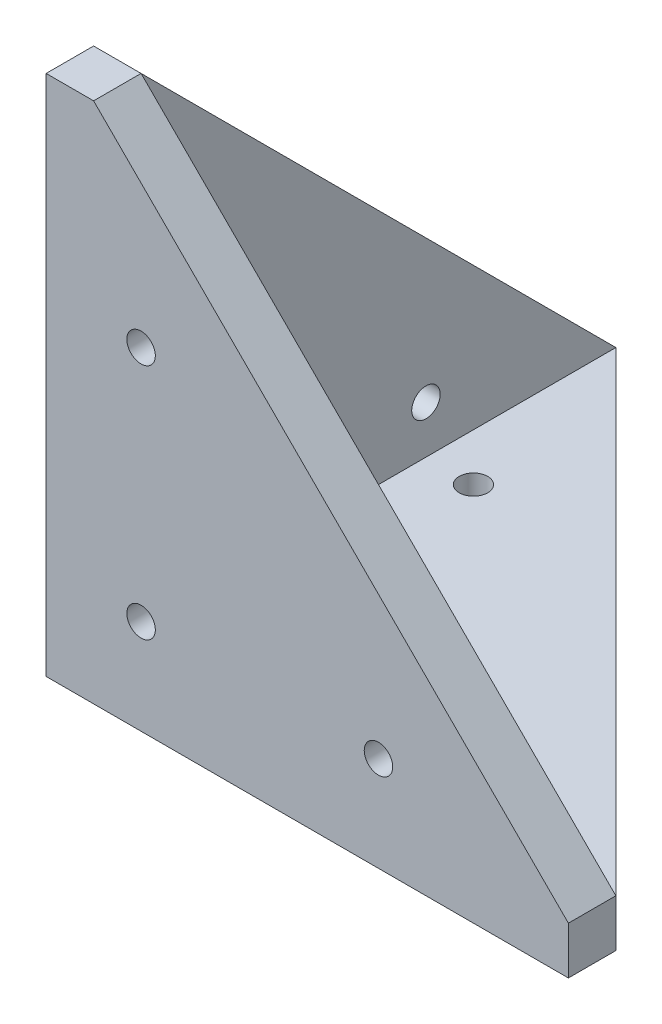
from build123d import *

# Parameters (mm, degrees)
EXTRUDE_1_DEPTH     = 5
EXTRUDE_2_DEPTH     = 5
SKETCH_4_W          = 5
SKETCH_4_H          = 5
EXTRUDE_4_DEPTH     = 50
EXTRUDE_13_DEPTH    = 5
SKETCH_8_R          = 1.5
SKETCH_8_R_2        = 1.4
CUT_EXTRUDE_1_DEPTH = 87.602540378
SKETCH_9_R          = 1.5
CUT_EXTRUDE_2_DEPTH = 87.602540378
SKETCH_10_R         = 1.5
CUT_EXTRUDE_3_DEPTH = 87.602540378


with BuildPart() as part:
    # 草图1 → 凸台-拉伸1 (new body)
    with BuildSketch(Plane.XY):
        Polygon((0, 50), (50, 0), (50, -5), (-5, -5), (-5, 50), align=None)
    extrude(amount=EXTRUDE_1_DEPTH)



with BuildPart() as body_2:
    # 草图2 → 凸台-拉伸2 (new body)
    with BuildSketch(Plane(origin=(0, 0, 0), x_dir=(0, 0, -1), z_dir=(1, 0, 0))):
        Polygon((0, 0), (50, 0), (0, 50), align=None)
    extrude(amount=-EXTRUDE_2_DEPTH)

    # 草图4 → 凸台-拉伸4 (add)
    with BuildSketch(Plane.XY):
        with Locations((-2.5, -2.5)):
            Rectangle(SKETCH_4_W, SKETCH_4_H)
    extrude(amount=-EXTRUDE_4_DEPTH)


with BuildPart() as part_1:
    add(part.part)

    add(body_2.part)  # 凸台-拉伸13 merges body 2
    # 草图7 → 凸台-拉伸13 (add)
    with BuildSketch(Plane.XZ.offset(5)):
        Polygon((50, 0), (0, 0), (0, -50), align=None)
    extrude(amount=-EXTRUDE_13_DEPTH)

    # 草图8 → 切除-拉伸1 (cut, through all)
    with BuildSketch(Plane(origin=(0, 0, 0), x_dir=(0, 0, -1), z_dir=(1, 0, 0))):
        with Locations((5, 30)):
            Circle(SKETCH_8_R)
        with Locations((5, 5)):
            Circle(SKETCH_8_R_2)
        with Locations((30, 5)):
            Circle(SKETCH_8_R)
    extrude(amount=-CUT_EXTRUDE_1_DEPTH, mode=Mode.SUBTRACT)

    # 草图9 → 切除-拉伸2 (cut, through all)
    with BuildSketch(Plane(origin=(0, 0, 0), x_dir=(-1, 0, 0), z_dir=(0, 0, -1))):
        with Locations((-5, 30)):
            Circle(SKETCH_9_R)
        with Locations((-5, 5)):
            Circle(SKETCH_9_R)
        with Locations((-30, 5)):
            Circle(SKETCH_9_R)
    extrude(amount=-CUT_EXTRUDE_2_DEPTH, mode=Mode.SUBTRACT)

    # 草图10 → 切除-拉伸3 (cut, through all)
    with BuildSketch(Plane(origin=(0, 0, 0), x_dir=(1, 0, 0), z_dir=(0, 1, 0))):
        with Locations(Location((5, 30, 0), (0, 0, 270))):
            Circle(SKETCH_10_R)
        with Locations(Location((5, 5, 0), (0, 0, 270))):
            Circle(SKETCH_10_R)
        with Locations(Location((30, 5, 0), (0, 0, 270))):
            Circle(SKETCH_10_R)
    extrude(amount=-CUT_EXTRUDE_3_DEPTH, mode=Mode.SUBTRACT)


solid = part_1.part
